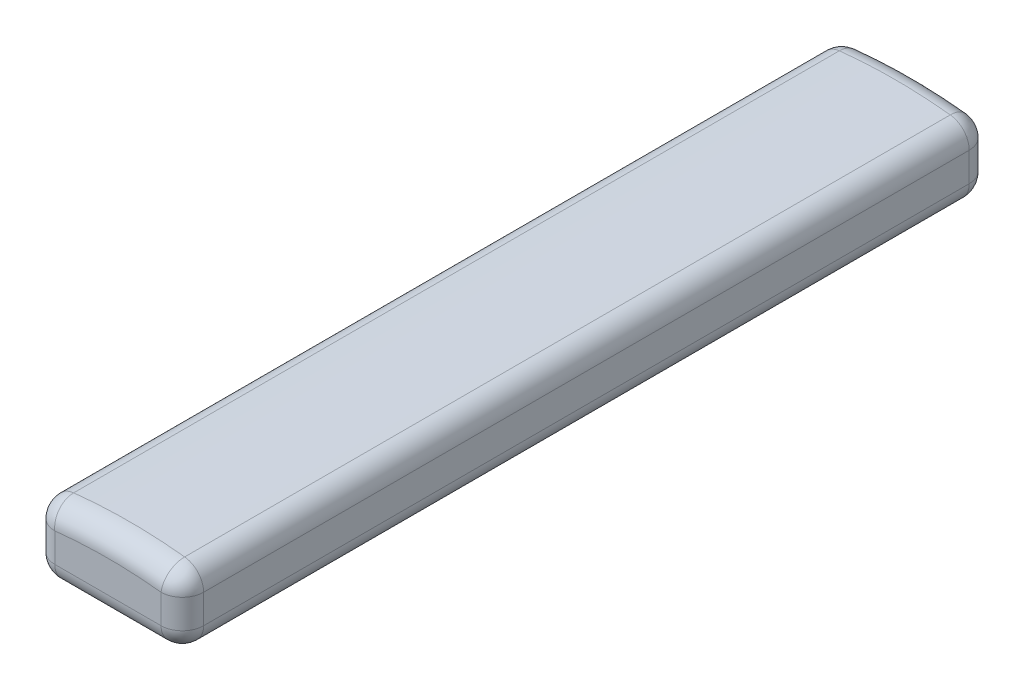
from build123d import *

# Parameters (mm, degrees)
SKETCH1_W           = 7
SKETCH1_H           = 3.5
BOSS_EXTRUDE1_DEPTH = 38
SKETCH2_R           = 29
SKETCH2_R_2         = 24
CUT_EXTRUDE1_DEPTH  = 39.200948941
FILLET1_R           = 1


with BuildPart() as part:
    # Sketch1 → Boss-Extrude1 (new body)
    with BuildSketch(Plane.XY):
        Rectangle(SKETCH1_W, SKETCH1_H)
    extrude(amount=BOSS_EXTRUDE1_DEPTH)

    # Sketch2 → Cut-Extrude1 (cut, through all)
    with BuildSketch(Plane.XY.offset(38)):
        with Locations((0, -22.25)):
            Circle(SKETCH2_R)
        with Locations((0, -22.25)):
            Circle(SKETCH2_R_2, mode=Mode.SUBTRACT)
    extrude(amount=-CUT_EXTRUDE1_DEPTH, mode=Mode.SUBTRACT)

    # Fillet1
    fillet1_edges = [part.edges().sort_by_distance(p)[0] for p in [
        (0, -1.75, 38),
        (-3.5, -0.128289929, 0),
        (0, 1.75, 0),
        (-3.5, -0.128289929, 38),
        (0, 1.75, 38),
        (3.5, 1.493420141, 19),
        (-3.5, 1.493420141, 19),
        (3.5, -0.128289929, 38),
        (0, -1.75, 0),
        (3.5, -0.128289929, 0),
        (3.5, -1.75, 19),
        (-3.5, -1.75, 19),
    ]]
    fillet(fillet1_edges, radius=FILLET1_R)


solid = part.part
